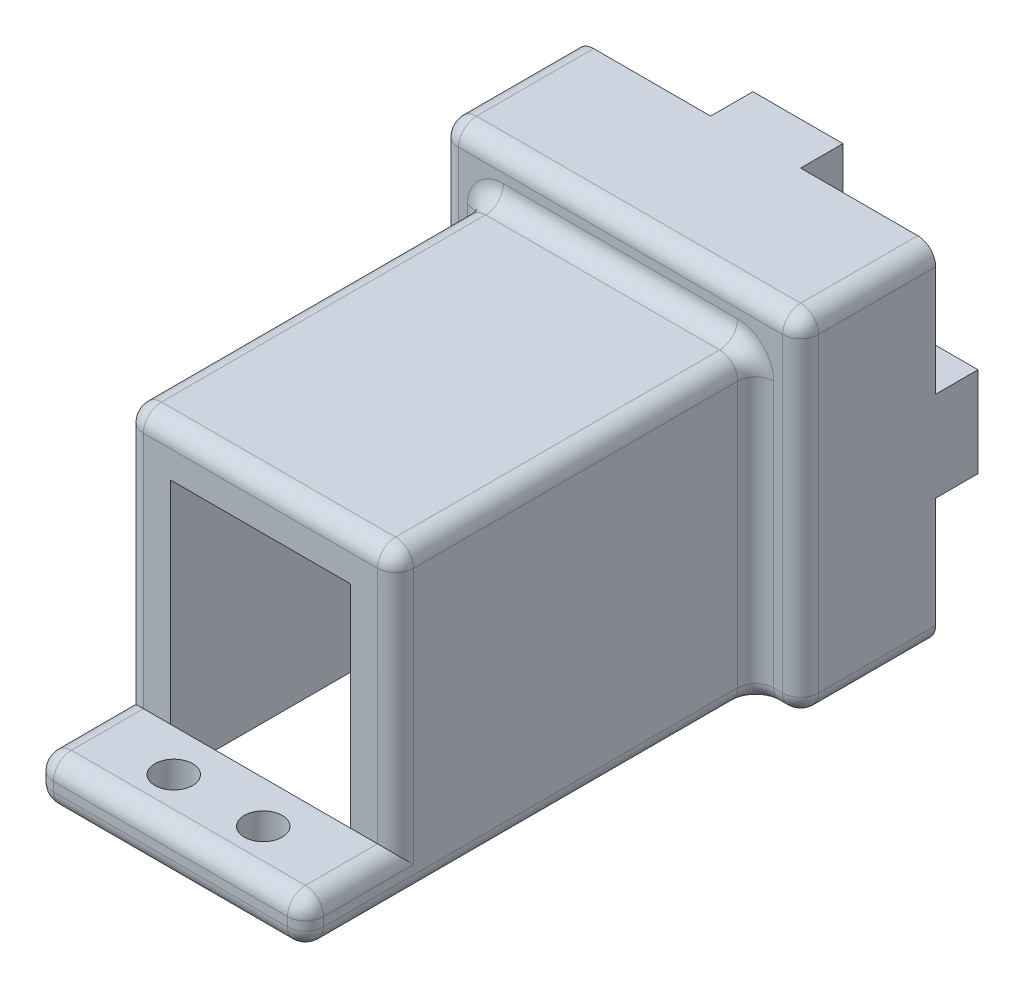
from build123d import *

# Parameters (mm, degrees)
SKETCH1_W           = 30
SKETCH1_H           = 33.5
SKETCH1_W_2         = 20
SKETCH1_H_2         = 23.5
BOSS_EXTRUDE1_DEPTH = 10
SKETCH1_4_W         = 30
SKETCH1_4_H         = 33.5
SKETCH1_4_W_2       = 20
SKETCH1_4_H_2       = 23.5
BOSS_EXTRUDE2_DEPTH = 5
SKETCH2_W           = 40
SKETCH2_H           = 38.5
BOSS_EXTRUDE3_DEPTH = 10
BOSS_EXTRUDE4_DEPTH = 40
SKETCH4_W           = 30
SKETCH4_H           = 5
BOSS_EXTRUDE5_DEPTH = 10
SKETCH5_R           = 2.1
CUT_EXTRUDE1_DEPTH  = 5
FILLET1_R           = 2
SKETCH6_W           = 10
SKETCH6_H           = 5
SKETCH6_W_2         = 5
SKETCH6_H_2         = 10
BOSS_EXTRUDE6_DEPTH = 4.7
SKETCH7_W           = 20
SKETCH7_H           = 15
CUT_EXTRUDE2_DEPTH  = 15


with BuildPart() as part:
    # Sketch1 → Boss-Extrude1 (new body)
    # profile 1 of 3: a face of its own
    with BuildSketch(Plane.XY):
        Polygon((-20, 19.25), (-20, -19.25), (-15, -19.25), (-15, 14.25), (15, 14.25), (15, -19.25), (20, -19.25), (20, 19.25), align=None)
    # profile 2 of 3: a face of its own
    with BuildSketch(Plane.XY):
        with Locations((0, -2.5)):
            Rectangle(SKETCH1_W, SKETCH1_H)
        with Locations((0, -2.5)):
            Rectangle(SKETCH1_W_2, SKETCH1_H_2, mode=Mode.SUBTRACT)
    # profile 3 of 3: a face of its own
    with BuildSketch(Plane.XY):
        with Locations((0, -2.5)):
            Rectangle(SKETCH1_W_2, SKETCH1_H_2)
    extrude(amount=-BOSS_EXTRUDE1_DEPTH)

    # Sketch1<4> → Boss-Extrude2 (add)
    with BuildSketch(Plane.XY):
        with Locations((0, -2.5)):
            Rectangle(SKETCH1_4_W, SKETCH1_4_H)
        with Locations((0, -2.5)):
            Rectangle(SKETCH1_4_W_2, SKETCH1_4_H_2, mode=Mode.SUBTRACT)
    extrude(amount=BOSS_EXTRUDE2_DEPTH)

    # Sketch2 → Boss-Extrude3 (add)
    with BuildSketch(Plane.XY.offset(5)):
        Rectangle(SKETCH2_W, SKETCH2_H)
    extrude(amount=-BOSS_EXTRUDE3_DEPTH)

    # Sketch3 → Boss-Extrude4 (add)
    with BuildSketch(Plane.XY.offset(5)):
        Polygon((-10, -19.25), (-10, -14.25), (-10, 9.25), (10, 9.25), (10, -14.25), (10, -19.25), (15, -19.25), (15, 14.25), (-15, 14.25), (-15, -19.25), align=None)
    extrude(amount=BOSS_EXTRUDE4_DEPTH)

    # Sketch4 → Boss-Extrude5 (add)
    with BuildSketch(Plane.XY.offset(45)):
        with Locations((0, -16.75)):
            Rectangle(SKETCH4_W, SKETCH4_H)
    extrude(amount=BOSS_EXTRUDE5_DEPTH)

    # Sketch5 → Cut-Extrude1 (cut)
    with BuildSketch(Plane.XZ.offset(19.25)):
        with Locations(Location((4.97, 49.66, 0), (0, 0, 270))):
            Circle(SKETCH5_R)
        with Locations(Location((-4.97, 49.66, 0), (0, 0, 270))):
            Circle(SKETCH5_R)
    extrude(amount=-CUT_EXTRUDE1_DEPTH, mode=Mode.SUBTRACT)

    # Fillet1
    fillet1_edges = [part.edges().sort_by_distance(p)[0] for p in [
        (-15, -14.25, 50),
        (15, -14.25, 50),
        (-15, -16.75, 55),
        (-20, 19.25, -2.5),
        (0, -19.25, 55),
        (15, -16.75, 55),
        (0, -14.25, 55),
        (20, 19.25, -2.5),
        (20, -19.25, -2.5),
        (-20, -19.25, -2.5),
        (-17.5, -19.25, 5),
        (20, 0, 5),
        (0, 19.25, 5),
        (-20, 0, 5),
        (17.5, -19.25, 5),
        (0, 14.25, 5),
        (15, 14.25, 25),
        (-15, -2.5, 5),
        (-15, 14.25, 25),
        (-15, -19.25, 30),
        (15, -2.5, 5),
        (15, -19.25, 30),
        (0, 14.25, 45),
        (-15, 0, 45),
        (15, 0, 45),
    ]]
    fillet(fillet1_edges, radius=FILLET1_R)

    # Sketch6 → Boss-Extrude6 (add)
    with BuildSketch(Plane(origin=(0, 0, -10), x_dir=(-1, 0, 0), z_dir=(0, 0, -1))):
        with Locations((0, -16.75)):
            Rectangle(SKETCH6_W, SKETCH6_H)
        with Locations((17.5, 0)):
            Rectangle(SKETCH6_W_2, SKETCH6_H_2)
        with Locations((0, 16.75)):
            Rectangle(SKETCH6_W, SKETCH6_H)
        with Locations((-17.5, 0)):
            Rectangle(SKETCH6_W_2, SKETCH6_H_2)
    extrude(amount=BOSS_EXTRUDE6_DEPTH)

    # Sketch7 → Cut-Extrude2 (cut)
    with BuildSketch(Plane.XY.offset(5)):
        with Locations((0, 1.75)):
            Rectangle(SKETCH7_W, SKETCH7_H)
    extrude(amount=-CUT_EXTRUDE2_DEPTH, mode=Mode.SUBTRACT)


solid = part.part
